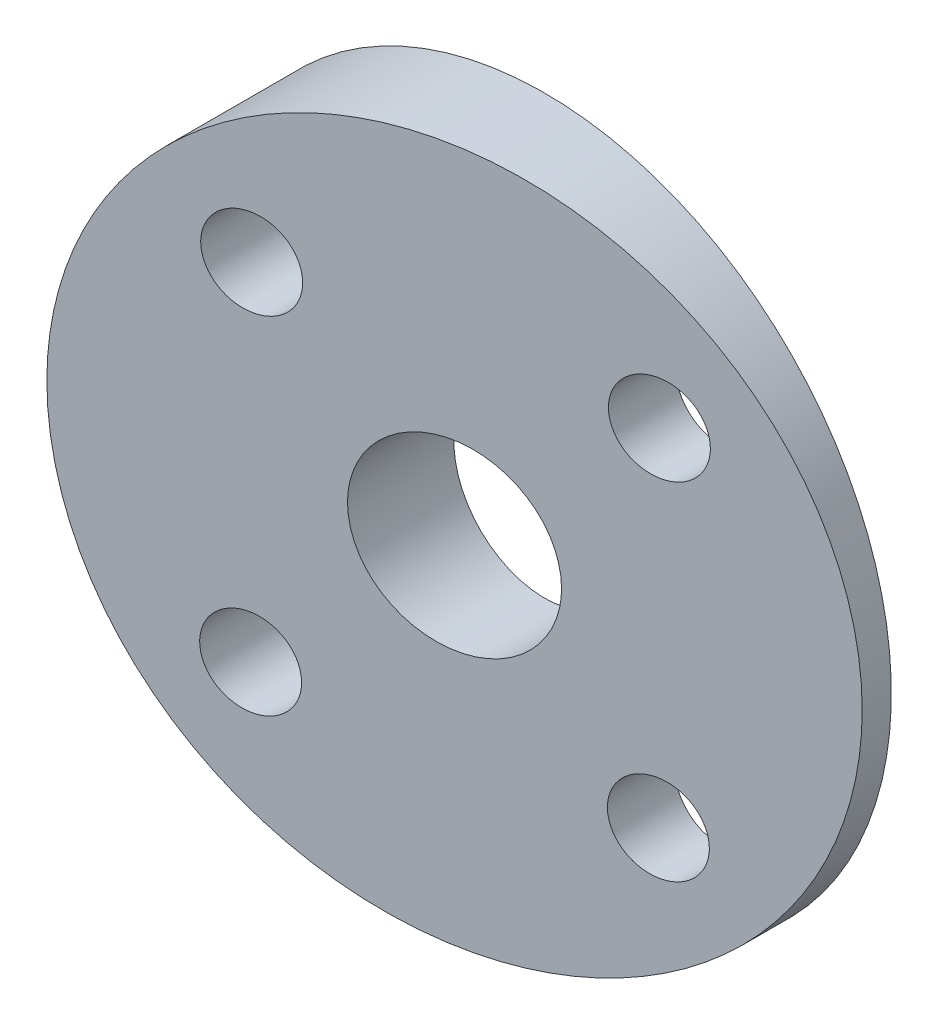
from build123d import *

# Parameters (mm, degrees)
SKETCH1_W           = 41.85
SKETCH1_H           = 10
SKETCH1_W_2         = 10
SKETCH1_H_2         = 29
BOSS_EXTRUDE1_DEPTH = 48
SKETCH4_R           = 2
SKETCH4_R_2         = 4.2
CUT_EXTRUDE2_DEPTH  = 48
SKETCH7_W           = 100.326592526
SKETCH7_H           = 57.143742852
CUT_EXTRUDE5_DEPTH  = 14.7
CUT_EXTRUDE6_DEPTH  = 54.7
BOSS_EXTRUDE5_DEPTH = 13.7
SKETCH19_W          = 55.248240751
SKETCH19_H          = 86.451998217
SKETCH19_R          = 16
CUT_EXTRUDE10_DEPTH = 13.7


with BuildPart() as part:
    # Sketch1 → Boss-Extrude1 (new body)
    with BuildSketch(Plane(origin=(0, 0, 0), x_dir=(1, 0, 0), z_dir=(0, 1, 0))):
        with Locations((-10.925, 5)):
            Rectangle(SKETCH1_W, SKETCH1_H)
        with Locations((5, -14.5)):
            Rectangle(SKETCH1_W_2, SKETCH1_H_2)
    extrude(amount=BOSS_EXTRUDE1_DEPTH)

    # Sketch4 → Cut-Extrude2 (cut)
    with BuildSketch(Plane.XY):
        with Locations((-5.589559388, 40.980827232)):
            Circle(SKETCH4_R)
        with Locations((-5.629681083, 24.979051073)):
            Circle(SKETCH4_R)
        with Locations((-21.591335547, 41.020948927)):
            Circle(SKETCH4_R)
        with Locations((-21.631457243, 25.019172768)):
            Circle(SKETCH4_R)
        with Locations((-13.629681083, 32.979051073)):
            Circle(SKETCH4_R_2)
    extrude(amount=-CUT_EXTRUDE2_DEPTH, mode=Mode.SUBTRACT)

    # Sketch7 → Cut-Extrude5 (cut)
    with BuildSketch(Plane.XZ):
        with Locations((-16.144605738, 7.803574406)):
            Rectangle(SKETCH7_W, SKETCH7_H)
    extrude(amount=-CUT_EXTRUDE5_DEPTH, mode=Mode.SUBTRACT)

    # Sketch8 → Cut-Extrude6 (cut)
    with BuildSketch(Plane.XZ.offset(-14.7)):
        Polygon((-31.85, -2.620715857), (10, -10), (10, 29), (0, 29), (0, 0), (-31.85, 0), align=None)
    extrude(amount=-CUT_EXTRUDE6_DEPTH, mode=Mode.SUBTRACT)

    # Sketch18 → Boss-Extrude5 (add)
    with BuildSketch(Plane(origin=(0, 48, 0), x_dir=(1, 0, 0), z_dir=(0, 1, 0))):
        Polygon((-31.85, 2.620715857), (-31.85, 10), (10, 10), align=None)
    extrude(amount=BOSS_EXTRUDE5_DEPTH)

    # Sketch19 → Cut-Extrude10 (cut)
    with BuildSketch(Plane(origin=(0, 0, -10), x_dir=(-1, 0, 0), z_dir=(0, 0, -1))):
        with Locations((12.788642717, 43.225999109)):
            Rectangle(SKETCH19_W, SKETCH19_H)
        with Locations((13.629681083, 32.979051073)):
            Circle(SKETCH19_R, mode=Mode.SUBTRACT)
    extrude(amount=-CUT_EXTRUDE10_DEPTH, mode=Mode.SUBTRACT)


solid = part.part
